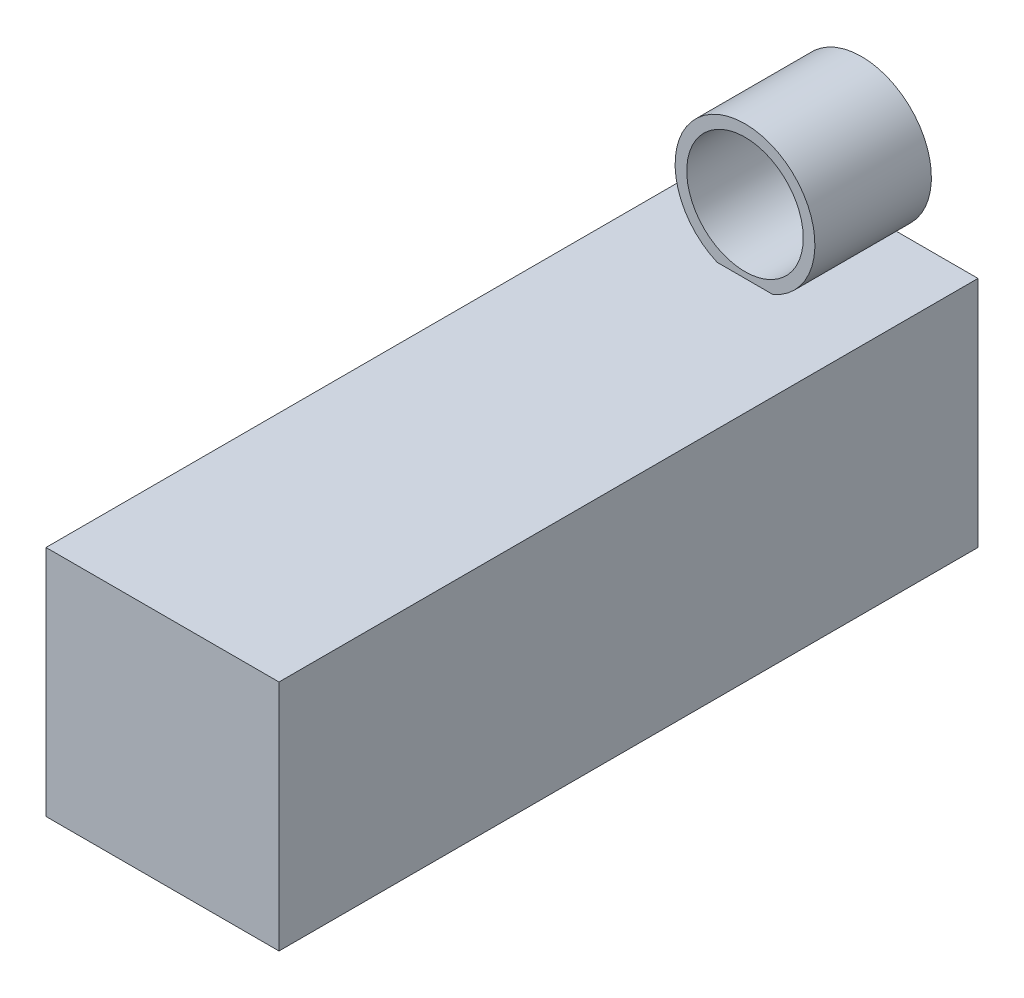
from build123d import *

# Parameters (mm, degrees)
SKETCH1_W           = 20
SKETCH1_H           = 20
BOSS_EXTRUDE1_DEPTH = 60
SKETCH2_R           = 2.6
CUT_EXTRUDE1_DEPTH  = 5
SKETCH3_R           = 6
SKETCH3_R_2         = 5
BOSS_EXTRUDE2_DEPTH = 10


with BuildPart() as part:
    # Sketch1 → Boss-Extrude1 (new body)
    with BuildSketch(Plane.XY):
        with Locations((10, -10)):
            Rectangle(SKETCH1_W, SKETCH1_H)
    extrude(amount=BOSS_EXTRUDE1_DEPTH)

    # Sketch2 → Cut-Extrude1 (cut)
    with BuildSketch(Plane.XZ.offset(20)):
        with Locations(Location((10, 30, 0), (0, 0, 270))):
            Circle(SKETCH2_R)
    extrude(amount=-CUT_EXTRUDE1_DEPTH, mode=Mode.SUBTRACT)

    # Sketch3 → Boss-Extrude2 (add)
    with BuildSketch(Plane.XY):
        with Locations((10, 5.5)):
            Circle(SKETCH3_R)
        with Locations((10, 5.5)):
            Circle(SKETCH3_R_2, mode=Mode.SUBTRACT)
    extrude(amount=BOSS_EXTRUDE2_DEPTH)


solid = part.part
